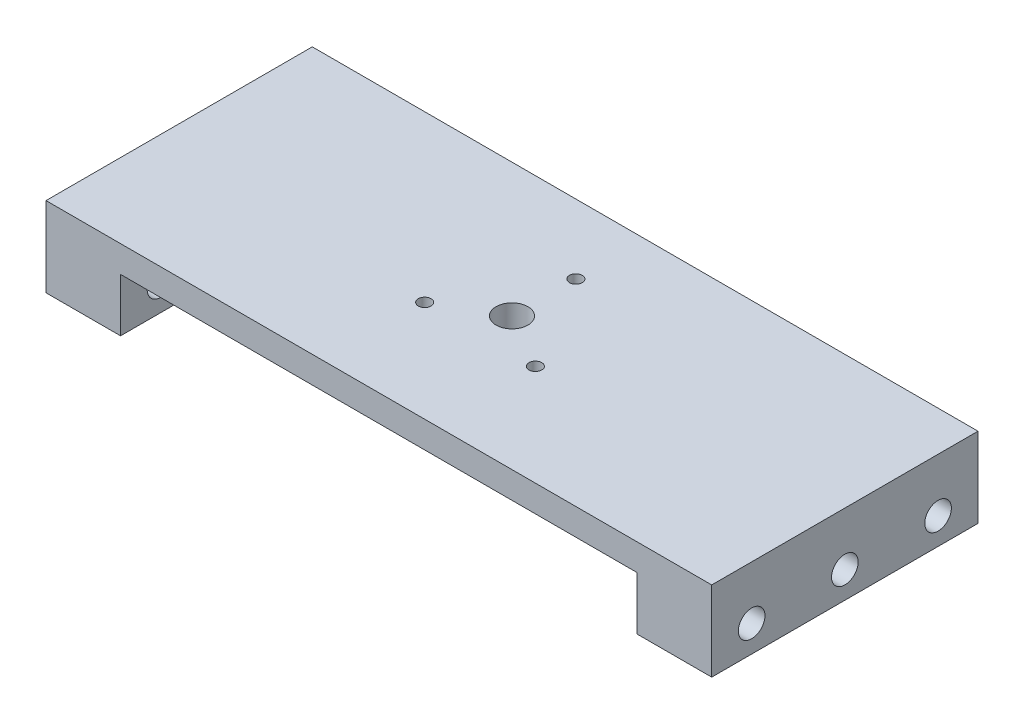
from build123d import *

# Parameters (mm, degrees)
EXTRUDE_1_DEPTH     = 10
SKETCH_4_W          = 28
SKETCH_4_H          = 100
EXTRUDE_2_DEPTH     = 20
SKETCH_5_R          = 5
CUT_EXTRUDE_2_DEPTH = 30
SKETCH_9_R          = 2.4
CUT_EXTRUDE_4_DEPTH = 10
SKETCH_10_R         = 6
CUT_EXTRUDE_5_DEPTH = 10


with BuildPart() as part:
    # 草图1 → 凸台-拉伸1 (new body)
    with BuildSketch(Plane(origin=(0, 0, 0), x_dir=(1, 0, 0), z_dir=(0, 1, 0))):
        Polygon((0, -50), (125, -50), (125, 50), (-125, 50), (-125, -50), align=None)
    extrude(amount=EXTRUDE_1_DEPTH)

    # 草图4 → 凸台-拉伸2 (add)
    with BuildSketch(Plane.XZ):
        with Locations((-111, 0)):
            Rectangle(SKETCH_4_W, SKETCH_4_H)
    extrude_2 = extrude(amount=EXTRUDE_2_DEPTH)

    # 镜向1: 凸台-拉伸2 across plane
    add(extrude_2.mirror(Plane(origin=(0, 0, 0), x_dir=(0, 0, 1), z_dir=(1, 0, 0))))

    # 草图5 → 切除-拉伸2 (cut)
    with BuildSketch(Plane(origin=(125, 0, 0), x_dir=(0, 0, -1), z_dir=(1, 0, 0))):
        with Locations((0, -10)):
            Circle(SKETCH_5_R)
        with Locations((-35, -10)):
            Circle(SKETCH_5_R)
        with Locations((35, -10)):
            Circle(SKETCH_5_R)
    cut_extrude_2 = extrude(amount=-CUT_EXTRUDE_2_DEPTH, mode=Mode.SUBTRACT)

    # 镜向2: 切除-拉伸2 across plane
    add(cut_extrude_2.mirror(Plane(origin=(0, 0, 0), x_dir=(0, 0, 1), z_dir=(1, 0, 0))), mode=Mode.SUBTRACT)

    # 草图9 → 切除-拉伸4 (cut)
    with BuildSketch(Plane(origin=(0, 10, 0), x_dir=(1, 0, 0), z_dir=(0, 1, 0))):
        with Locations(Location((0, 24, 0), (0, 0, 270))):
            Circle(SKETCH_9_R)
        with Locations(Location((20.784609691, -12, 0), (0, 0, 270))):
            Circle(SKETCH_9_R)
        with Locations(Location((-20.784609691, -12, 0), (0, 0, 270))):
            Circle(SKETCH_9_R)
    extrude(amount=-CUT_EXTRUDE_4_DEPTH, mode=Mode.SUBTRACT)

    # 草图10 → 切除-拉伸5 (cut)
    with BuildSketch(Plane(origin=(0, 10, 0), x_dir=(1, 0, 0), z_dir=(0, 1, 0))):
        with Locations(Location((0, 0, 0), (0, 0, 270))):
            Circle(SKETCH_10_R)
    extrude(amount=-CUT_EXTRUDE_5_DEPTH, mode=Mode.SUBTRACT)


solid = part.part
